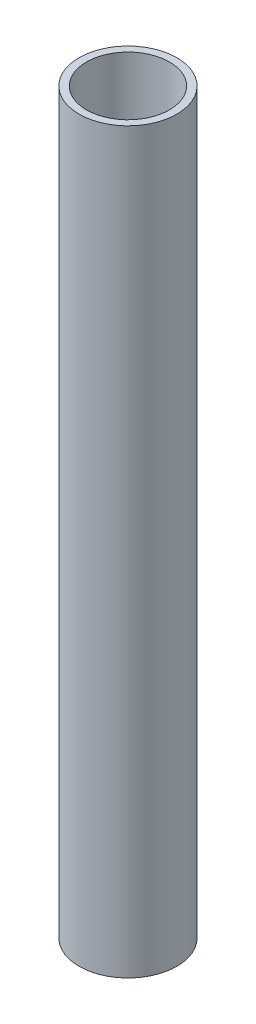
from build123d import *

# Parameters (mm, degrees)
SKETCH1_R           = 7.95
SKETCH1_R_2         = 6.75
BOSS_EXTRUDE1_DEPTH = 120


with BuildPart() as part:
    # Sketch1 → Boss-Extrude1 (new body)
    with BuildSketch(Plane(origin=(0, 0, 0), x_dir=(1, 0, 0), z_dir=(0, 1, 0))):
        with Locations(Location((0, 0, 0), (0, 0, 270))):
            Circle(SKETCH1_R)
        with Locations(Location((0, 0, 0), (0, 0, 270))):
            Circle(SKETCH1_R_2, mode=Mode.SUBTRACT)
    extrude(amount=BOSS_EXTRUDE1_DEPTH)


solid = part.part
